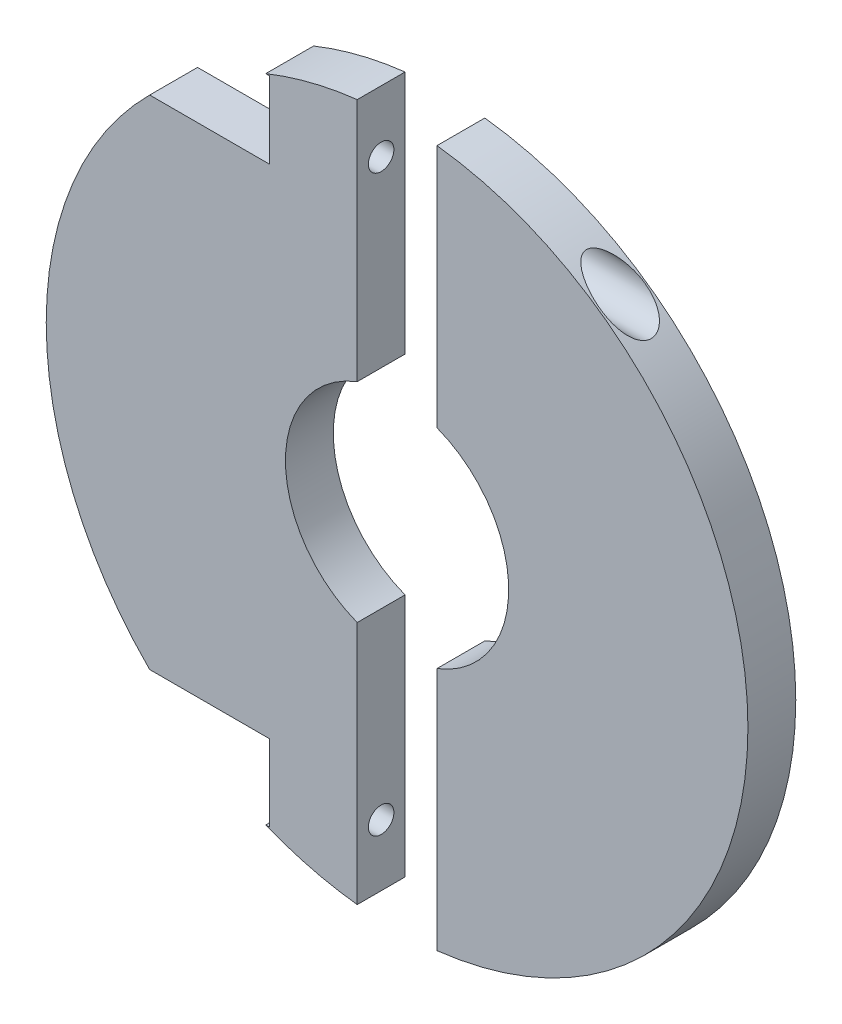
from build123d import *

# Parameters (mm, degrees)
SKETCH1_R               = 55
BOSS_EXTRUDE1_DEPTH     = 7.5
SKETCH2_R               = 17.5
CUT_EXTRUDE1_DEPTH      = 79.14249804
SKETCH3_W               = 12.5
SKETCH3_H               = 122.150565914
CUT_EXTRUDE2_DEPTH      = 79.14249804
CUT_EXTRUDE3_DEPTH      = 78.892153007
CUT_EXTRUDE3_DEPTH_BACK = 78.892153007
SKETCH4_R               = 2
CUT_EXTRUDE5_START      = 40
SKETCH5_R               = 3.5
CUT_EXTRUDE5_DEPTH      = 20
CUT_EXTRUDE6_START      = -20
SKETCH6_W               = 7.5
SKETCH6_H               = 12
CUT_EXTRUDE6_DEPTH      = 20


with BuildPart() as part:
    # Sketch1 → Boss-Extrude1 (new body)
    with BuildSketch(Plane.XY):
        Circle(SKETCH1_R)
    extrude(amount=BOSS_EXTRUDE1_DEPTH)

    # Sketch2 → Cut-Extrude1 (cut, through all)
    with BuildSketch(Plane.XY.offset(7.5)):
        Circle(SKETCH2_R)
    extrude(amount=-CUT_EXTRUDE1_DEPTH, mode=Mode.SUBTRACT)

    # Sketch3 → Cut-Extrude2 (cut, through all)
    with BuildSketch(Plane.XY.offset(7.5)):
        Rectangle(SKETCH3_W, SKETCH3_H)
    extrude(amount=-CUT_EXTRUDE2_DEPTH, mode=Mode.SUBTRACT)


with BuildPart() as cut_extrude2_piece_1:
    # of the separate pieces the step leaves, piece 1, a body of its own (cut_extrude2_pieces)
    add(part.part.solids().sort_by_distance((6.25, -54.643732486, 0))[0])


with BuildPart() as cut_extrude2_piece_2:
    # of the separate pieces the step leaves, piece 2, a body of its own (cut_extrude2_pieces)
    add(part.part.solids().sort_by_distance((-6.25, 54.643732486, 0))[0])


with BuildPart() as cut_extrude3_tool:
    # Sketch4 → Cut-Extrude3 (new, two sides: drawn at the far end of the back side and taken through both)
    with BuildSketch(Plane(origin=(0, 0, 0), x_dir=(0, 0, -1), z_dir=(1, 0, 0)).offset(-CUT_EXTRUDE3_DEPTH_BACK)):
        with Locations((-3.75, 45)):
            Circle(SKETCH4_R)
        with Locations((-3.75, -45)):
            Circle(SKETCH4_R)
    extrude(amount=CUT_EXTRUDE3_DEPTH + CUT_EXTRUDE3_DEPTH_BACK)


with BuildPart() as cut_extrude2_piece_1_1:
    add(cut_extrude2_piece_1.part)

    # Cut-Extrude3: cut by cut_extrude3_tool
    add(cut_extrude3_tool.part, mode=Mode.SUBTRACT)

    # Sketch5 → Cut-Extrude5 (cut)
    with BuildSketch(Plane(origin=(0, 0, 0), x_dir=(0, 0, -1), z_dir=(1, 0, 0)).offset(CUT_EXTRUDE5_START)):
        with Locations((-3.75, 45)):
            Circle(SKETCH5_R)
        with Locations((-3.75, -45)):
            Circle(SKETCH5_R)
    extrude(amount=-CUT_EXTRUDE5_DEPTH, mode=Mode.SUBTRACT)


with BuildPart() as cut_extrude2_piece_2_1:
    add(cut_extrude2_piece_2.part)

    # Cut-Extrude3: cut by cut_extrude3_tool
    add(cut_extrude3_tool.part, mode=Mode.SUBTRACT)

    # Sketch6 → Cut-Extrude6 (cut)
    with BuildSketch(Plane(origin=(0, 0, 0), x_dir=(0, 0, -1), z_dir=(1, 0, 0)).offset(CUT_EXTRUDE6_START)):
        with Locations((-3.75, 45)):
            Rectangle(SKETCH6_W, SKETCH6_H)
        with Locations((-3.75, -45)):
            Rectangle(SKETCH6_W, SKETCH6_H)
    extrude(amount=-CUT_EXTRUDE6_DEPTH, mode=Mode.SUBTRACT)


solid = Compound([cut_extrude2_piece_1_1.part, cut_extrude2_piece_2_1.part])
